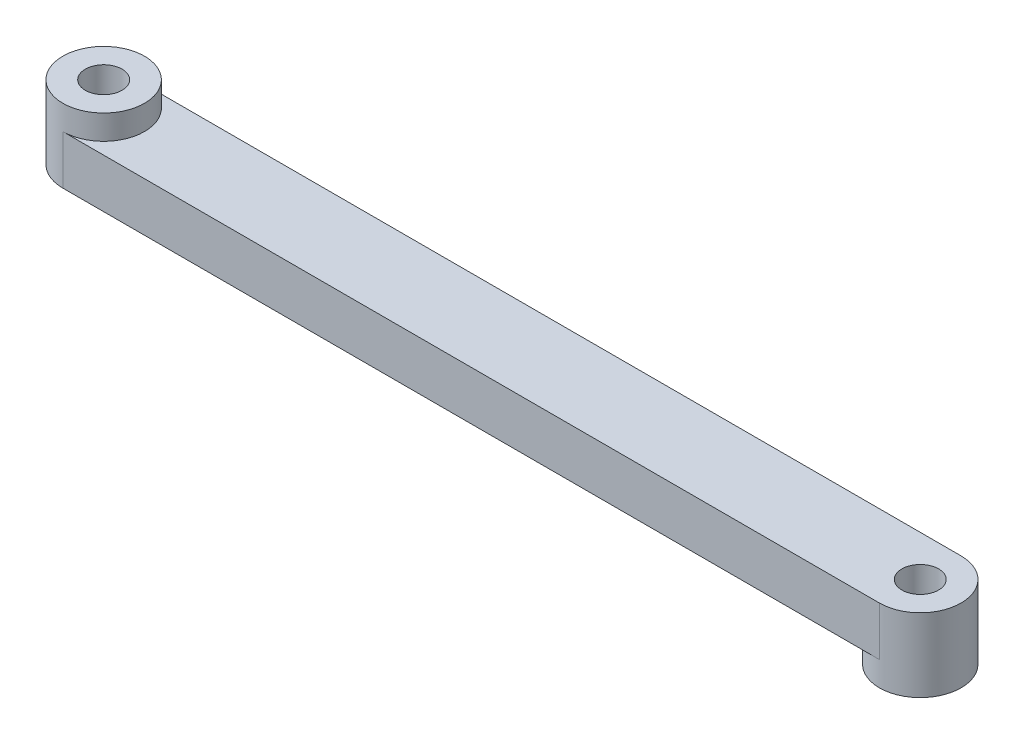
from build123d import *

# Parameters (mm, degrees)
SKETCH1_R               = 2.25
BOSS_EXTRUDE1_DEPTH     = 12
CUT_EXTRUDE_THIN1_START = -3
SKETCH2_R               = 1005
SKETCH2_R_2             = 5
CUT_EXTRUDE_THIN1_DEPTH = 3
SKETCH3_R               = 1005
SKETCH3_R_2             = 5
CUT_EXTRUDE_THIN2_DEPTH = 3


with BuildPart() as part:
    # Sketch1 → Boss-Extrude1 (new body)
    with BuildSketch(Plane(origin=(0, 0, 0), x_dir=(1, 0, 0), z_dir=(0, 1, 0))):
        with BuildLine():
            Line((0, 5), (100, 5))
            ThreePointArc((100, 5), (105, 0), (100, -5))
            Line((100, -5), (0, -5))
            ThreePointArc((0, -5), (-5, 0), (0, 5))
        make_face()
        with Locations(Location((0, 0, 0), (0, 0, 270))):
            Circle(SKETCH1_R, mode=Mode.SUBTRACT)
        with Locations(Location((100, 0, 0), (0, 0, 270))):
            Circle(SKETCH1_R, mode=Mode.SUBTRACT)
    extrude(amount=BOSS_EXTRUDE1_DEPTH)

    # Sketch2 → Cut-Extrude-Thin1 (cut)
    with BuildSketch(Plane(origin=(0, 12, 0), x_dir=(1, 0, 0), z_dir=(0, 1, 0)).offset(CUT_EXTRUDE_THIN1_START)):
        Circle(SKETCH2_R)
        Circle(SKETCH2_R_2, mode=Mode.SUBTRACT)
    extrude(amount=CUT_EXTRUDE_THIN1_DEPTH, mode=Mode.SUBTRACT)

    # Sketch3 → Cut-Extrude-Thin2 (cut)
    with BuildSketch(Plane.XZ):
        with Locations((100, 0)):
            Circle(SKETCH3_R)
        with Locations((100, 0)):
            Circle(SKETCH3_R_2, mode=Mode.SUBTRACT)
    extrude(amount=-CUT_EXTRUDE_THIN2_DEPTH, mode=Mode.SUBTRACT)


solid = part.part
